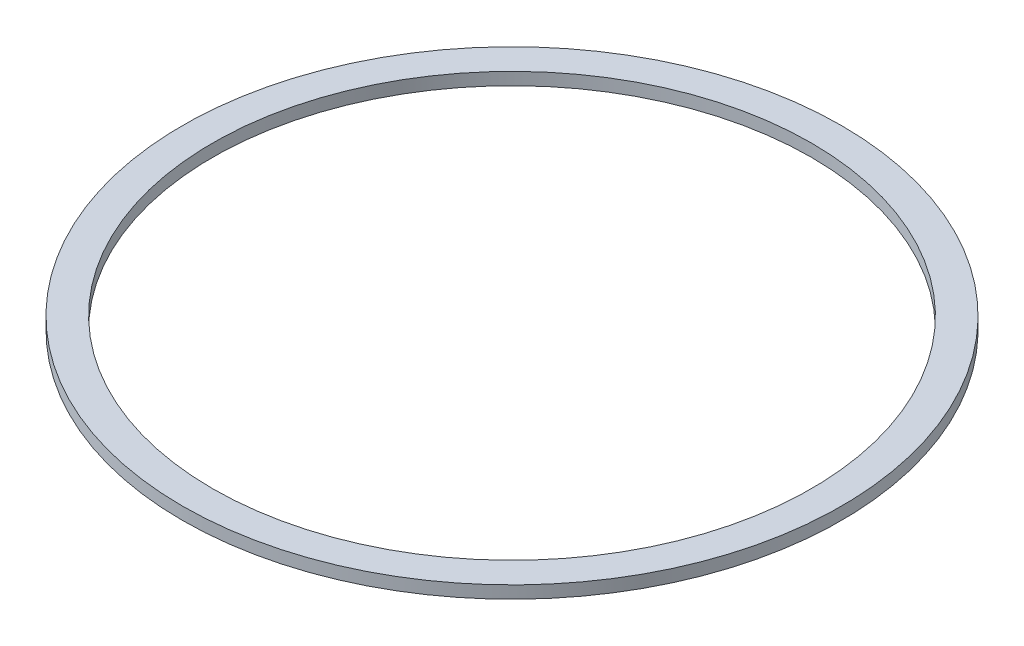
from build123d import *

# Parameters (mm, degrees)
SKETCH_1_R      = 53
SKETCH_1_R_2    = 48.15
EXTRUDE_1_DEPTH = 2


with BuildPart() as part:
    # 草图1 → 凸台-拉伸1 (new body)
    with BuildSketch(Plane(origin=(0, 0, 0), x_dir=(1, 0, 0), z_dir=(0, 1, 0))):
        with Locations(Location((0, 0, 0), (0, 0, 270))):
            Circle(SKETCH_1_R)
        with Locations(Location((0, 0, 0), (0, 0, 270))):
            Circle(SKETCH_1_R_2, mode=Mode.SUBTRACT)
    extrude(amount=EXTRUDE_1_DEPTH)


solid = part.part
